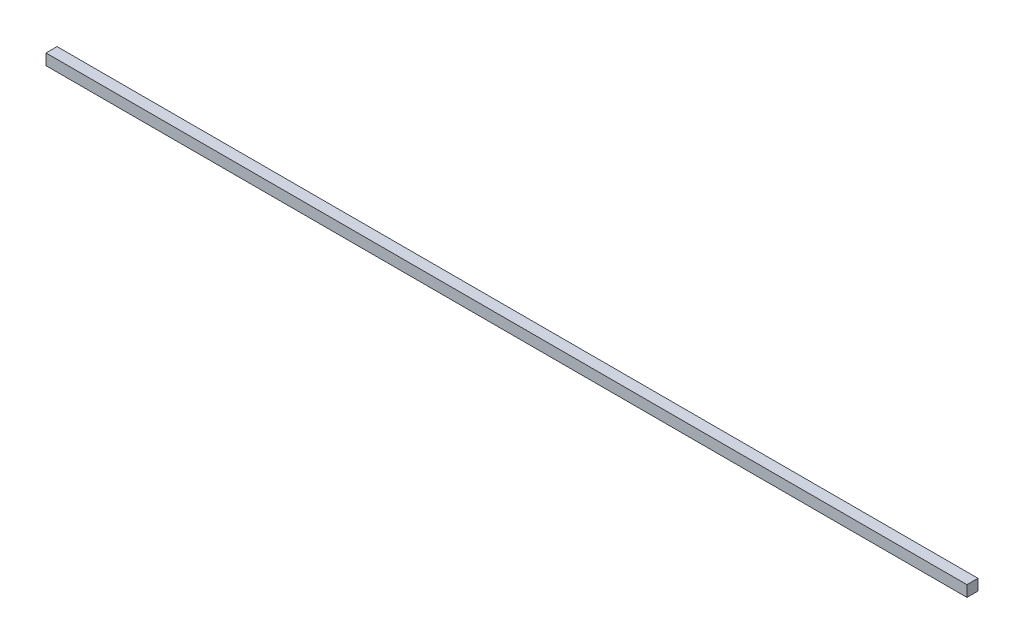
from build123d import *

# Parameters (mm, degrees)
SKETCH_1_W      = 30
SKETCH_1_H      = 30
EXTRUDE_1_DEPTH = 2502


with BuildPart() as part:
    # 草图1 → 凸台-拉伸1 (new body)
    with BuildSketch(Plane(origin=(0, 0, 0), x_dir=(0, 0, -1), z_dir=(1, 0, 0))):
        Rectangle(SKETCH_1_W, SKETCH_1_H)
    extrude(amount=EXTRUDE_1_DEPTH)


solid = part.part
